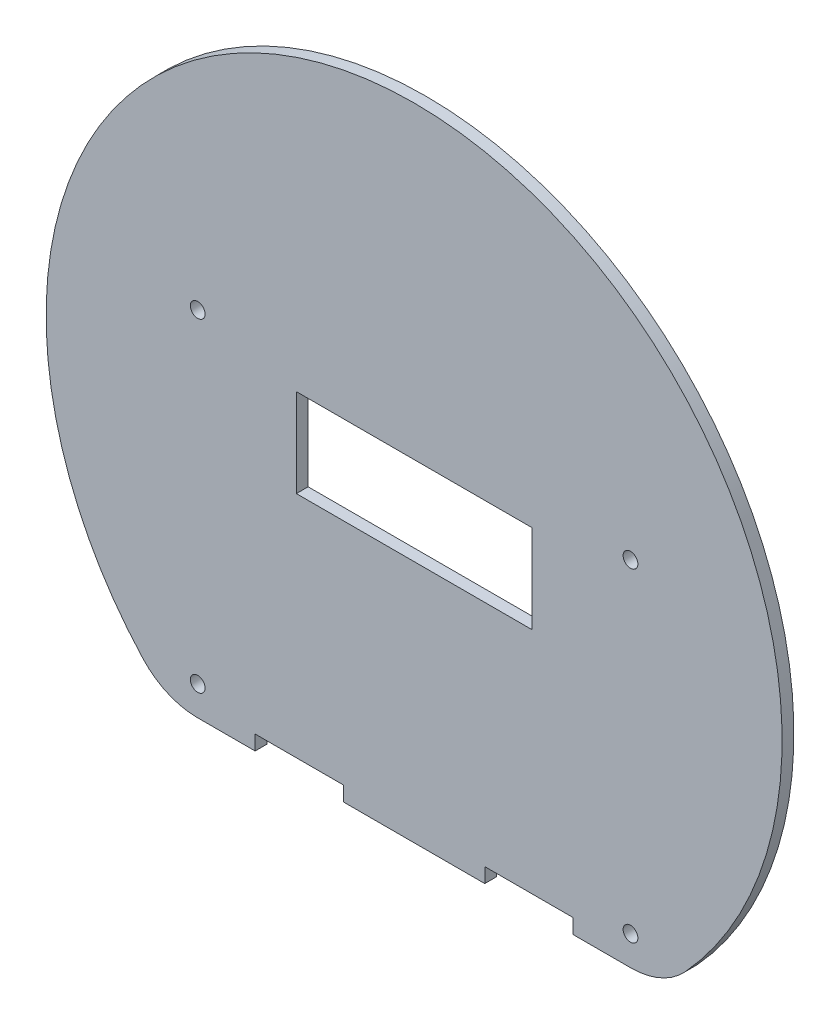
from build123d import *

# Parameters (mm, degrees)
SKETCH1_R           = 125
BOSS_EXTRUDE1_DEPTH = 4
CUT_EXTRUDE2_START  = -10
CUT_EXTRUDE2_DEPTH  = 10
FILLET1_R           = 25
SKETCH6_W           = 30
SKETCH6_H           = 5
CUT_EXTRUDE5_DEPTH  = 5
SKETCH7_R           = 2.5
CUT_EXTRUDE6_DEPTH  = 177.821944339
SKETCH8_W           = 80
SKETCH8_H           = 30
CUT_EXTRUDE7_DEPTH  = 177.821944339


with BuildPart() as part:
    # Sketch1 → Boss-Extrude1 (new body)
    with BuildSketch(Plane.XY):
        Circle(SKETCH1_R)
    extrude(amount=BOSS_EXTRUDE1_DEPTH)

    # Sketch3 → Cut-Extrude2 (cut)
    with BuildSketch(Plane.XY.offset(4).offset(CUT_EXTRUDE2_START)):
        with BuildLine():
            Line((-83.915537646, -92.645466924), (83.915537646, -92.645466924))
            ThreePointArc((83.915537646, -92.645466924), (0, -125), (-83.915537646, -92.645466924))
        make_face()
    extrude(amount=CUT_EXTRUDE2_DEPTH, mode=Mode.SUBTRACT)

    # Fillet1
    fillet1_edges = [part.edges().sort_by_distance(p)[0] for p in [
        (83.915537646, -92.645466924, 2),
        (-83.915537646, -92.645466924, 2),
    ]]
    fillet(fillet1_edges, radius=FILLET1_R)

    # Sketch6 → Cut-Extrude5 (cut)
    with BuildSketch(Plane.XY.offset(4)):
        with Locations((39, -90.145466924)):
            Rectangle(SKETCH6_W, SKETCH6_H)
        with Locations((-39, -90.145466924)):
            Rectangle(SKETCH6_W, SKETCH6_H)
    extrude(amount=-CUT_EXTRUDE5_DEPTH, mode=Mode.SUBTRACT)

    # Sketch7 → Cut-Extrude6 (cut, through all)
    with BuildSketch(Plane.XY.offset(4)):
        with Locations((73.5, -82.645466924)):
            Circle(SKETCH7_R)
        with Locations((73.5, 27.354533076)):
            Circle(SKETCH7_R)
        with Locations((-73.5, 27.354533076)):
            Circle(SKETCH7_R)
        with Locations((-73.5, -82.645466924)):
            Circle(SKETCH7_R)
    extrude(amount=-CUT_EXTRUDE6_DEPTH, mode=Mode.SUBTRACT)

    # Sketch8 → Cut-Extrude7 (cut, through all)
    with BuildSketch(Plane.XY.offset(4)):
        with Locations((0, 5.074477417)):
            Rectangle(SKETCH8_W, SKETCH8_H)
    extrude(amount=-CUT_EXTRUDE7_DEPTH, mode=Mode.SUBTRACT)


solid = part.part
